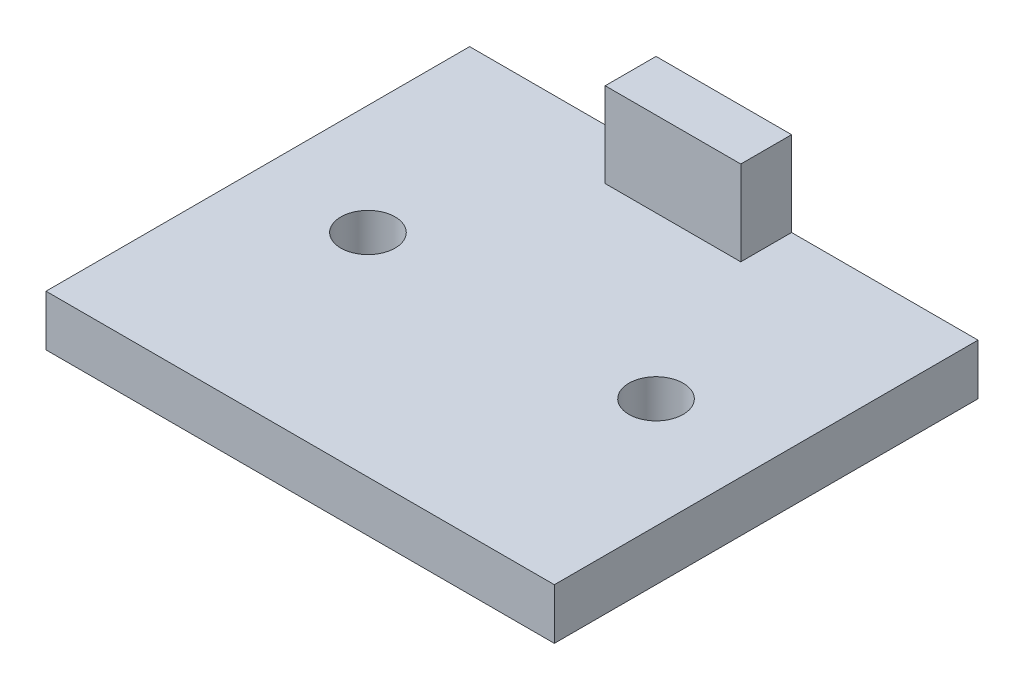
from build123d import *

# Parameters (mm, degrees)
SKETCH1_W           = 30
SKETCH1_H           = 25
BOSS_EXTRUDE1_DEPTH = 3
SKETCH2_R           = 1.6
CUT_EXTRUDE2_DEPTH  = 10
SKETCH3_W           = 8
SKETCH3_H           = 3
BOSS_EXTRUDE2_DEPTH = 5


with BuildPart() as part:
    # Sketch1 → Boss-Extrude1 (new body)
    with BuildSketch(Plane(origin=(0, 0, 0), x_dir=(1, 0, 0), z_dir=(0, 1, 0))):
        with Locations((-7.290640394, 2.155172414)):
            Rectangle(SKETCH1_W, SKETCH1_H)
    extrude(amount=BOSS_EXTRUDE1_DEPTH)

    # Sketch2 → Cut-Extrude2 (cut)
    with BuildSketch(Plane(origin=(0, 3, 0), x_dir=(1, 0, 0), z_dir=(0, 1, 0))):
        with Locations(Location((-15.790640394, 2.155172414, 0), (0, 0, 270))):
            Circle(SKETCH2_R)
        with Locations(Location((1.209359606, 2.155172414, 0), (0, 0, 270))):
            Circle(SKETCH2_R)
    extrude(amount=-CUT_EXTRUDE2_DEPTH, mode=Mode.SUBTRACT)

    # Sketch3 → Boss-Extrude2 (add)
    with BuildSketch(Plane(origin=(0, 3, 0), x_dir=(1, 0, 0), z_dir=(0, 1, 0))):
        with Locations((-7.290640394, 13.155172414)):
            Rectangle(SKETCH3_W, SKETCH3_H)
    extrude(amount=BOSS_EXTRUDE2_DEPTH)


solid = part.part
